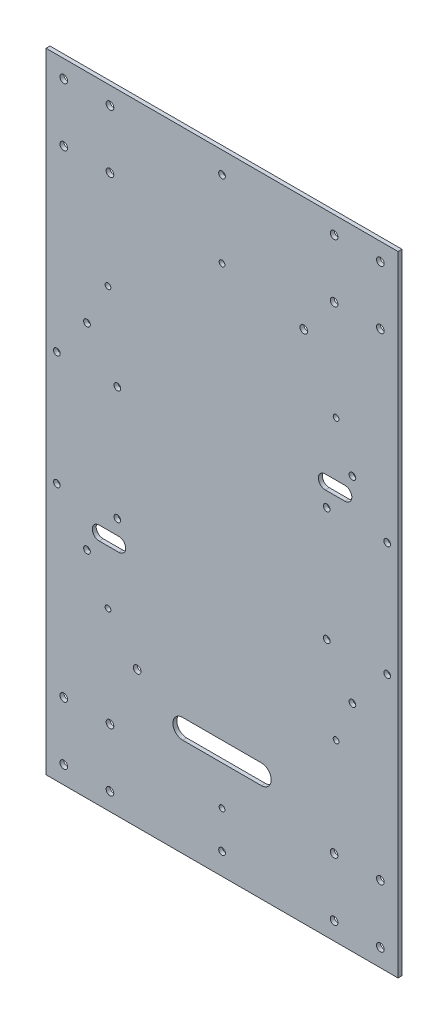
from build123d import *

# Parameters (mm, degrees)
CROQUIS1_W                     = 179
CROQUIS1_H                     = 320
SALIENTE_EXTRUIR1_DEPTH        = 2
TALADRO_DE_MARGEN_PARA_M31_D   = 3.4
TALADRO_DE_MARGEN_PARA_M2_51_D = 2.9
TALADRO_DE_MARGEN_PARA_M32_D   = 3.4
CORTAR_EXTRUIR1_DEPTH          = 184.34189374
TALADRO_DE_MARGEN_PARA_M3_51_D = 3.9
SIMETR_A4_COPY_1_D             = 3.9
TALADRO_DE_MARGEN_PARA_M3_52_D = 3.9
CORTAR_EXTRUIR2_DEPTH          = 184.34189374


with BuildPart() as part:
    # Croquis1 → Saliente-Extruir1 (new body)
    with BuildSketch(Plane.XY):
        Rectangle(CROQUIS1_W, CROQUIS1_H)
    extrude(amount=SALIENTE_EXTRUIR1_DEPTH)

    # Taladro de margen para M31 (through all)
    with Locations(Plane.XY.offset(2)):
        with Locations((0, 149), (-68.69, 49.42), (-68.69, -50.58), (0, -149), (66.31, -50.58), (66.31, 49.42)):
            Hole(TALADRO_DE_MARGEN_PARA_M31_D / 2)

    # Taladro de margen para M2.51 (through all)
    with Locations(Plane.XY.offset(2)):
        with Locations((0, 110), (-58, 71), (-58, -71), (0, -130), (58, -71), (58, 71)):
            Hole(TALADRO_DE_MARGEN_PARA_M2_51_D / 2)

    # Taladro de margen para M32 (through all)
    with Locations(Plane.XY.offset(2)):
        with Locations((-84, 29), (-84, -29), (-53.252582689, 29), (-53.252582689, -29), (53.252582689, 29), (84, 29), (84, -29), (53.252582689, -29)):
            Hole(TALADRO_DE_MARGEN_PARA_M32_D / 2)

    # Croquis10 → Cortar-Extruir1 (cut, through all)
    with BuildSketch(Plane.XY.offset(2)):
        with BuildLine():
            Line((-62.5, -36.5), (-52.5, -36.5))
            ThreePointArc((-52.5, -36.5), (-49, -40), (-52.5, -43.5))
            Line((-52.5, -43.5), (-62.5, -43.5))
            ThreePointArc((-62.5, -43.5), (-66, -40), (-62.5, -36.5))
        make_face()
        with BuildLine():
            Line((52.5, 43.5), (62.5, 43.5))
            ThreePointArc((62.5, 43.5), (66, 40), (62.5, 36.5))
            Line((62.5, 36.5), (52.5, 36.5))
            ThreePointArc((52.5, 36.5), (49, 40), (52.5, 43.5))
        make_face()
    extrude(amount=-CORTAR_EXTRUIR1_DEPTH, mode=Mode.SUBTRACT)

    # Taladro de margen para M3.51 (through all)
    with Locations(Plane.XY.offset(2)):
        with Locations((-80.5, -121.42), (-57, -121.42), (-57, -151), (-80.5, -151)):
            taladro_de_margen_para_m3_51 = Hole(TALADRO_DE_MARGEN_PARA_M3_51_D / 2)

    # Simetría3: Taladro de margen para M3.51 across plane
    add(taladro_de_margen_para_m3_51.mirror(Plane.ZX), mode=Mode.SUBTRACT)

    # Simetría4: Taladro de margen para M3.51 across plane
    add(taladro_de_margen_para_m3_51.mirror(Plane(origin=(0, 0, 0), x_dir=(0, 0, 1), z_dir=(1, 0, 0))), mode=Mode.SUBTRACT)

    # Simetría4 copy 1 (through all)
    with Locations(Plane(origin=(0, 0, 2), x_dir=(-1, 0, 0), z_dir=(0, 0, 1))):
        with Locations((-80.5, -121.42), (-57, -121.42), (-57, -151), (-80.5, -151)):
            Hole(SIMETR_A4_COPY_1_D / 2)

    # Taladro de margen para M3.52 (through all)
    with Locations(Plane(origin=(0, 0, 0), x_dir=(-1, 0, 0), z_dir=(0, 0, -1))):
        with Locations((-41.6, 101.784994015), (43.2, -90.415005985)):
            Hole(TALADRO_DE_MARGEN_PARA_M3_52_D / 2)

    # Croquis17 → Cortar-Extruir2 (cut, through all)
    with BuildSketch(Plane(origin=(0, 0, 0), x_dir=(-1, 0, 0), z_dir=(0, 0, -1))):
        with BuildLine():
            Line((20, -110), (-20, -110))
            ThreePointArc((-20, -110), (-25, -105), (-20, -100))
            Line((-20, -100), (20, -100))
            ThreePointArc((20, -100), (25, -105), (20, -110))
        make_face()
    extrude(amount=-CORTAR_EXTRUIR2_DEPTH, mode=Mode.SUBTRACT)


solid = part.part
